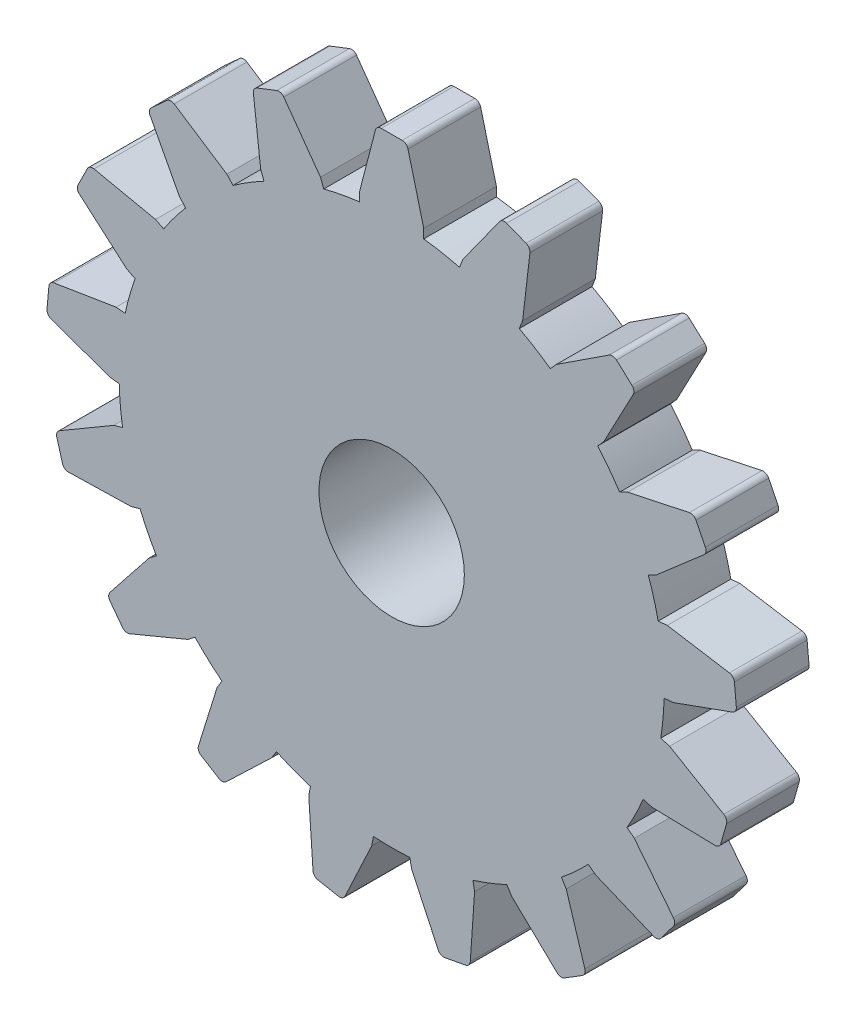
from build123d import *

# Parameters (mm, degrees)
SKETCH1_R                = 11.25
SKETCH1_R_2              = 3
BOSS_EXTRUDE1_DEPTH      = 3
BOSS_EXTRUDE2_DEPTH      = 3
FILLET1_R                = 0.25
CIRPATTERN1_COUNT        = 17
FILLET1_OF_CIRPATTERN1_R = 0.25
BOSS_EXTRUDE3_START      = -3.5
SKETCH3_R                = 5
SKETCH3_R_2              = 3
BOSS_EXTRUDE3_DEPTH      = 3.5


with BuildPart() as part:
    # Sketch1 → Boss-Extrude1 (new body)
    with BuildSketch(Plane.XY):
        Circle(SKETCH1_R)
        Circle(SKETCH1_R_2, mode=Mode.SUBTRACT)
    extrude(amount=BOSS_EXTRUDE1_DEPTH)

    # Sketch2 → Boss-Extrude2 (add)
    with BuildSketch(Plane.XY):
        Polygon((-1.323267478, 10.75), (-1.323267478, 11.55), (-0.625, 14.25), (0.625, 14.25), (1.323267478, 11.55), (1.323267478, 10.75), align=None)
    boss_extrude2 = extrude(amount=BOSS_EXTRUDE2_DEPTH)

    # Fillet1
    fillet1_edges = [part.edges().sort_by_distance(p)[0] for p in [
        (0.625, 14.25, 1.5),
        (-0.625, 14.25, 1.5),
    ]]
    fillet(fillet1_edges, radius=FILLET1_R)

    # CirPattern1: Boss-Extrude2 ×17 about axis
    cirpattern1_axis = Axis((0, 0, 0), (0, 0, 1))
    for i in range(1, CIRPATTERN1_COUNT):
        add(boss_extrude2.rotate(cirpattern1_axis, i * 360 / CIRPATTERN1_COUNT))

    # Fillet1 of CirPattern1
    fillet1_of_cirpattern1_edges = [part.edges().sort_by_distance(p)[0] for p in [
        (-4.5648986, 13.51350531, 1.5),
        (-5.730488887, 13.061953228, 1.5),
        (-9.138282349, 10.951936848, 1.5),
        (-10.062043495, 10.109817293, 1.5),
        (-12.477490429, 6.911248627, 1.5),
        (-13.034663374, 5.792294513, 1.5),
        (-14.131544288, 1.937157983, 1.5),
        (-14.246879737, 0.692490262, 1.5),
        (-13.877054784, -3.298556582, 1.5),
        (-13.534976046, -4.500838636, 1.5),
        (-11.748392136, -8.088782801, 1.5),
        (-10.995098841, -9.086304335, 1.5),
        (-8.033044031, -11.786574082, 1.5),
        (-6.970272611, -12.444614286, 1.5),
        (-3.232788816, -13.892523222, 1.5),
        (-2.004072442, -14.122210119, 1.5),
        (2.004072442, -14.122210119, 1.5),
        (3.232788816, -13.892523222, 1.5),
        (6.970272611, -12.444614286, 1.5),
        (8.033044031, -11.786574082, 1.5),
        (10.995098841, -9.086304335, 1.5),
        (11.748392136, -8.088782801, 1.5),
        (13.534976046, -4.500838636, 1.5),
        (13.877054784, -3.298556582, 1.5),
        (14.246879737, 0.692490262, 1.5),
        (14.131544288, 1.937157983, 1.5),
        (13.034663374, 5.792294513, 1.5),
        (12.477490429, 6.911248627, 1.5),
        (10.062043495, 10.109817293, 1.5),
        (9.138282349, 10.951936848, 1.5),
        (5.730488887, 13.061953228, 1.5),
        (4.5648986, 13.51350531, 1.5),
    ]]
    fillet(fillet1_of_cirpattern1_edges, radius=FILLET1_OF_CIRPATTERN1_R)

    # Sketch3 → Boss-Extrude3 (add)
    with BuildSketch(Plane.XY.offset(BOSS_EXTRUDE3_START)):
        Circle(SKETCH3_R)
        Circle(SKETCH3_R_2, mode=Mode.SUBTRACT)
    extrude(amount=BOSS_EXTRUDE3_DEPTH)


solid = part.part
